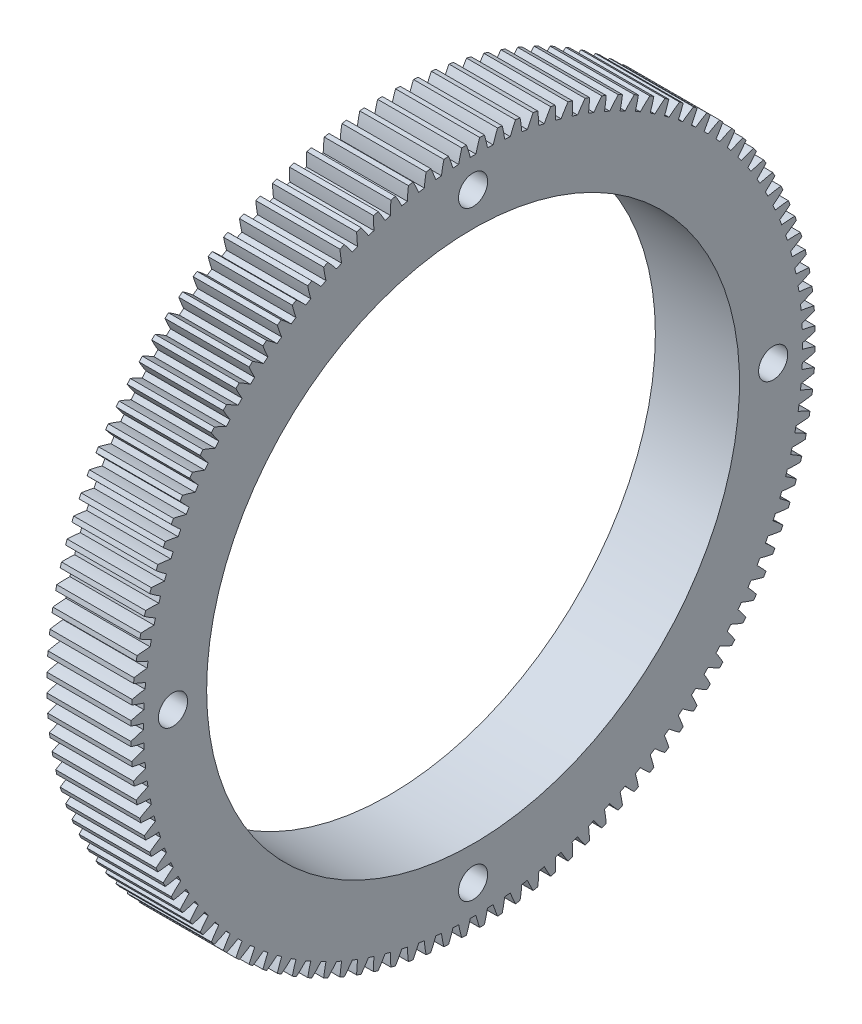
from build123d import *

# Parameters (mm, degrees)
BASPROSKE_W         = 15
BASPROSKE_H         = 61
TOOTHCUT_DEPTH      = 88.561407024
TEETHCUTS_COUNT     = 120
TEETHCUTS_ANGLE     = 357
BORSKE_R            = 47.5
BORE_DEPTH          = 50.0000508
SKETCH_1_R          = 2.6
CUT_EXTRUDE_1_DEPTH = 88.545519779


with BuildPart() as part:
    # BasProSke → Base-Revolve (revolve)
    with BuildSketch(Plane(origin=(0, 0, 0), x_dir=(1, 0, 0), z_dir=(0, 1, 0)), mode=Mode.PRIVATE) as base_revolve_sk:
        with Locations((7.5, 30.5)):
            Rectangle(BASPROSKE_W, BASPROSKE_H)
    revolve(base_revolve_sk.sketch.rotate(Axis((-10, 0, 0), (1, 0, 0)), 180), axis=Axis((-10, 0, 0), (1, 0, 0)))

    # TooCutSke → ToothCut (cut, through all)
    with BuildSketch(Plane(origin=(0, 0, 0), x_dir=(0, 0, -1), z_dir=(1, 0, 0))):
        with BuildLine():
            ThreePointArc((0.507616285, 58.746806949), (0, 58.749), (-0.507616285, 58.746806949))
            ThreePointArc((-0.507616285, 58.746806949), (-0.820012034, 59.888715039), (-1.188338468, 61.013828735))
            ThreePointArc((-1.188338468, 61.013828735), (0, 61.0254), (1.188338468, 61.013828735))
            ThreePointArc((1.188338468, 61.013828735), (0.820012034, 59.888715039), (0.507616285, 58.746806949))
        make_face()
    toothcut = extrude(amount=TOOTHCUT_DEPTH, mode=Mode.SUBTRACT)

    # TeethCuts: ToothCut ×120 about axis
    teethcuts_axis = Axis((-10, 0, 0), (1, 0, 0))
    for i in range(1, TEETHCUTS_COUNT):
        add(toothcut.rotate(teethcuts_axis, i * TEETHCUTS_ANGLE / (TEETHCUTS_COUNT - 1)), mode=Mode.SUBTRACT)

    # BorSke → Bore (cut, symmetric)
    with BuildSketch(Plane(origin=(0, 0, 0), x_dir=(0, 0, -1), z_dir=(1, 0, 0))):
        with Locations(Location((0, 0, 0), (0, 0, 180))):
            Circle(BORSKE_R)
    extrude(amount=BORE_DEPTH, both=True, mode=Mode.SUBTRACT)

    # 草图1 → 切除-拉伸1 (cut, through all)
    with BuildSketch(Plane.ZY):
        with Locations((0, 53.5)):
            Circle(SKETCH_1_R)
        with Locations((53.5, 0)):
            Circle(SKETCH_1_R)
        with Locations((0, -53.5)):
            Circle(SKETCH_1_R)
        with Locations((-53.5, 0)):
            Circle(SKETCH_1_R)
    extrude(amount=-CUT_EXTRUDE_1_DEPTH, mode=Mode.SUBTRACT)


solid = part.part
